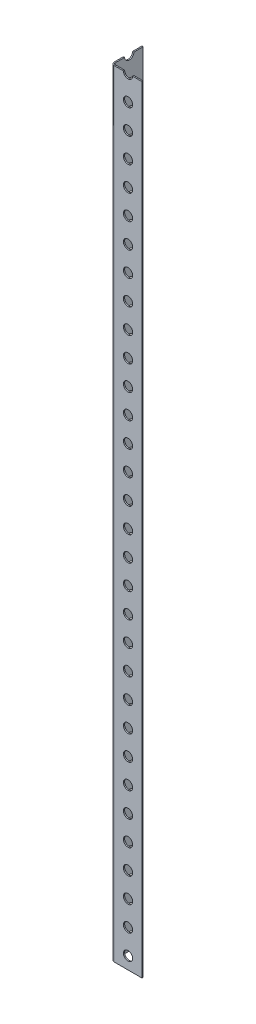
from build123d import *

# Parameters (mm, degrees)
BOSS_EXTRUDE1_DEPTH = 1219.2
SKETCH3_R           = 4.7625
CUT_EXTRUDE1_DEPTH  = 1.27
SKETCH4_R           = 4.7625
CUT_EXTRUDE2_DEPTH  = 1.27
FILLET1_R           = 3.175
FILLET2_R           = 1.5875
CUT_EXTRUDE3_DEPTH  = 419.1


with BuildPart() as part:
    # Sketch1 → Boss-Extrude1 (new body)
    with BuildSketch(Plane(origin=(0, 0, 0), x_dir=(1, 0, 0), z_dir=(0, 1, 0))):
        Polygon((1.27, 1.27), (1.27, 30.48), (1.27, 31.75), (0, 31.75), (0, 0), (31.75, 0), (31.75, 1.27), (30.48, 1.27), align=None)
    extrude(amount=BOSS_EXTRUDE1_DEPTH)

    # Sketch3 → Cut-Extrude1 (cut)
    with BuildSketch(Plane.ZY):
        with Locations((-17.4625, 12.7)):
            Circle(SKETCH3_R)
        with Locations((-17.4625, 38.1)):
            Circle(SKETCH3_R)
        with Locations((-17.4625, 63.5)):
            Circle(SKETCH3_R)
        with Locations((-17.4625, 88.9)):
            Circle(SKETCH3_R)
        with Locations((-17.4625, 114.3)):
            Circle(SKETCH3_R)
        with Locations((-17.4625, 139.7)):
            Circle(SKETCH3_R)
        with Locations((-17.4625, 165.1)):
            Circle(SKETCH3_R)
        with Locations((-17.4625, 190.5)):
            Circle(SKETCH3_R)
        with Locations((-17.4625, 215.9)):
            Circle(SKETCH3_R)
        with Locations((-17.4625, 241.3)):
            Circle(SKETCH3_R)
        with Locations((-17.4625, 266.7)):
            Circle(SKETCH3_R)
        with Locations((-17.4625, 292.1)):
            Circle(SKETCH3_R)
        with Locations((-17.4625, 317.5)):
            Circle(SKETCH3_R)
        with Locations((-17.4625, 342.9)):
            Circle(SKETCH3_R)
        with Locations((-17.4625, 368.3)):
            Circle(SKETCH3_R)
        with Locations((-17.4625, 393.7)):
            Circle(SKETCH3_R)
        with Locations((-17.4625, 419.1)):
            Circle(SKETCH3_R)
        with Locations((-17.4625, 444.5)):
            Circle(SKETCH3_R)
        with Locations((-17.4625, 469.9)):
            Circle(SKETCH3_R)
        with Locations((-17.4625, 495.3)):
            Circle(SKETCH3_R)
        with Locations((-17.4625, 520.7)):
            Circle(SKETCH3_R)
        with Locations((-17.4625, 546.1)):
            Circle(SKETCH3_R)
        with Locations((-17.4625, 571.5)):
            Circle(SKETCH3_R)
        with Locations((-17.4625, 596.9)):
            Circle(SKETCH3_R)
        with Locations((-17.4625, 622.3)):
            Circle(SKETCH3_R)
        with Locations((-17.4625, 647.7)):
            Circle(SKETCH3_R)
        with Locations((-17.4625, 673.1)):
            Circle(SKETCH3_R)
        with Locations((-17.4625, 698.5)):
            Circle(SKETCH3_R)
        with Locations((-17.4625, 723.9)):
            Circle(SKETCH3_R)
        with Locations((-17.4625, 749.3)):
            Circle(SKETCH3_R)
        with Locations((-17.4625, 774.7)):
            Circle(SKETCH3_R)
        with Locations((-17.4625, 800.1)):
            Circle(SKETCH3_R)
        with Locations((-17.4625, 825.5)):
            Circle(SKETCH3_R)
        with Locations((-17.4625, 850.9)):
            Circle(SKETCH3_R)
        with Locations((-17.4625, 876.3)):
            Circle(SKETCH3_R)
        with Locations((-17.4625, 901.7)):
            Circle(SKETCH3_R)
        with Locations((-17.4625, 927.1)):
            Circle(SKETCH3_R)
        with Locations((-17.4625, 952.5)):
            Circle(SKETCH3_R)
        with Locations((-17.4625, 977.9)):
            Circle(SKETCH3_R)
        with Locations((-17.4625, 1003.3)):
            Circle(SKETCH3_R)
        with Locations((-17.4625, 1028.7)):
            Circle(SKETCH3_R)
        with Locations((-17.4625, 1054.1)):
            Circle(SKETCH3_R)
        with Locations((-17.4625, 1079.5)):
            Circle(SKETCH3_R)
        with Locations((-17.4625, 1104.9)):
            Circle(SKETCH3_R)
        with Locations((-17.4625, 1130.3)):
            Circle(SKETCH3_R)
        with Locations((-17.4625, 1155.7)):
            Circle(SKETCH3_R)
        with Locations((-17.4625, 1181.1)):
            Circle(SKETCH3_R)
        with Locations((-17.4625, 1206.5)):
            Circle(SKETCH3_R)
    extrude(amount=-CUT_EXTRUDE1_DEPTH, mode=Mode.SUBTRACT)

    # Sketch4 → Cut-Extrude2 (cut)
    with BuildSketch(Plane.XY):
        with Locations((17.4625, 1206.5)):
            Circle(SKETCH4_R)
        with Locations((17.4625, 1181.1)):
            Circle(SKETCH4_R)
        with Locations((17.4625, 1155.7)):
            Circle(SKETCH4_R)
        with Locations((17.4625, 1130.3)):
            Circle(SKETCH4_R)
        with Locations((17.4625, 1104.9)):
            Circle(SKETCH4_R)
        with Locations((17.4625, 1079.5)):
            Circle(SKETCH4_R)
        with Locations((17.4625, 1054.1)):
            Circle(SKETCH4_R)
        with Locations((17.4625, 1028.7)):
            Circle(SKETCH4_R)
        with Locations((17.4625, 1003.3)):
            Circle(SKETCH4_R)
        with Locations((17.4625, 977.9)):
            Circle(SKETCH4_R)
        with Locations((17.4625, 952.5)):
            Circle(SKETCH4_R)
        with Locations((17.4625, 927.1)):
            Circle(SKETCH4_R)
        with Locations((17.4625, 901.7)):
            Circle(SKETCH4_R)
        with Locations((17.4625, 876.3)):
            Circle(SKETCH4_R)
        with Locations((17.4625, 850.9)):
            Circle(SKETCH4_R)
        with Locations((17.4625, 825.5)):
            Circle(SKETCH4_R)
        with Locations((17.4625, 800.1)):
            Circle(SKETCH4_R)
        with Locations((17.4625, 774.7)):
            Circle(SKETCH4_R)
        with Locations((17.4625, 749.3)):
            Circle(SKETCH4_R)
        with Locations((17.4625, 723.9)):
            Circle(SKETCH4_R)
        with Locations((17.4625, 698.5)):
            Circle(SKETCH4_R)
        with Locations((17.4625, 673.1)):
            Circle(SKETCH4_R)
        with Locations((17.4625, 647.7)):
            Circle(SKETCH4_R)
        with Locations((17.4625, 622.3)):
            Circle(SKETCH4_R)
        with Locations((17.4625, 596.9)):
            Circle(SKETCH4_R)
        with Locations((17.4625, 571.5)):
            Circle(SKETCH4_R)
        with Locations((17.4625, 546.1)):
            Circle(SKETCH4_R)
        with Locations((17.4625, 520.7)):
            Circle(SKETCH4_R)
        with Locations((17.4625, 495.3)):
            Circle(SKETCH4_R)
        with Locations((17.4625, 469.9)):
            Circle(SKETCH4_R)
        with Locations((17.4625, 444.5)):
            Circle(SKETCH4_R)
        with Locations((17.4625, 419.1)):
            Circle(SKETCH4_R)
        with Locations((17.4625, 393.7)):
            Circle(SKETCH4_R)
        with Locations((17.4625, 368.3)):
            Circle(SKETCH4_R)
        with Locations((17.4625, 342.9)):
            Circle(SKETCH4_R)
        with Locations((17.4625, 317.5)):
            Circle(SKETCH4_R)
        with Locations((17.4625, 292.1)):
            Circle(SKETCH4_R)
        with Locations((17.4625, 266.7)):
            Circle(SKETCH4_R)
        with Locations((17.4625, 241.3)):
            Circle(SKETCH4_R)
        with Locations((17.4625, 215.9)):
            Circle(SKETCH4_R)
        with Locations((17.4625, 190.5)):
            Circle(SKETCH4_R)
        with Locations((17.4625, 165.1)):
            Circle(SKETCH4_R)
        with Locations((17.4625, 139.7)):
            Circle(SKETCH4_R)
        with Locations((17.4625, 114.3)):
            Circle(SKETCH4_R)
        with Locations((17.4625, 88.9)):
            Circle(SKETCH4_R)
        with Locations((17.4625, 63.5)):
            Circle(SKETCH4_R)
        with Locations((17.4625, 38.1)):
            Circle(SKETCH4_R)
        with Locations((17.4625, 12.7)):
            Circle(SKETCH4_R)
    extrude(amount=-CUT_EXTRUDE2_DEPTH, mode=Mode.SUBTRACT)

    # Fillet1
    fillet1_edges = [part.edges().sort_by_distance(p)[0] for p in [
        (0, 609.6, 0),
    ]]
    fillet(fillet1_edges, radius=FILLET1_R)

    # Fillet2
    fillet2_edges = [part.edges().sort_by_distance(p)[0] for p in [
        (1.27, 609.6, -1.27),
    ]]
    fillet(fillet2_edges, radius=FILLET2_R)

    # Sketch5 → Cut-Extrude3 (cut)
    with BuildSketch(Plane(origin=(0, 1219.2, 0), x_dir=(1, 0, 0), z_dir=(0, 1, 0))):
        with BuildLine():
            Line((0, 31.75), (0, 3.175))
            ThreePointArc((0, 3.175), (0.92993597, 0.92993597), (3.175, 0))
            Line((3.175, 0), (31.75, 0))
            Line((31.75, 0), (31.75, 1.27))
            Line((31.75, 1.27), (2.8575, 1.27))
            ThreePointArc((2.8575, 1.27), (1.734967985, 1.734967985), (1.27, 2.8575))
            Line((1.27, 2.8575), (1.27, 31.75))
            Line((1.27, 31.75), (0, 31.75))
        make_face()
    extrude(amount=-CUT_EXTRUDE3_DEPTH, mode=Mode.SUBTRACT)


solid = part.part
